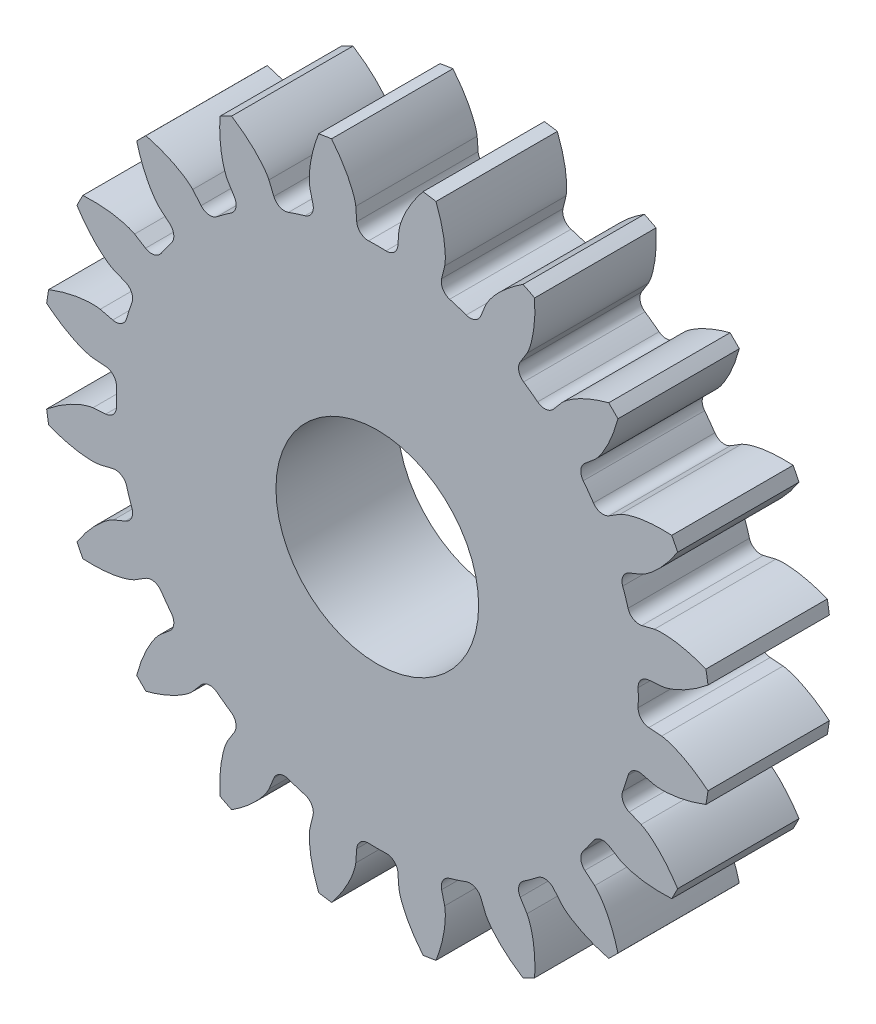
from build123d import *

# Parameters (mm, degrees)
BLANK_SKETCH_R    = 13.75
BLANK_DEPTH       = 5
TOOTH_SPACE_DEPTH = 21.077973005
TEETH_COUNT       = 20
BORE_DEPTH        = 20.90028246
BORE_DEPTH_BACK   = 20.90028246
BORE_SKETCH_R     = 4.175


with BuildPart() as part:
    # Blank Sketch → Blank (new body)
    with BuildSketch(Plane.XY):
        Circle(BLANK_SKETCH_R)
    extrude(amount=BLANK_DEPTH)

    # Tooth Space Sketch → Tooth Space (cut, symmetric)
    with BuildSketch(Plane.XY):
        with BuildLine():
            Line((11.712575542, 0.887578892), (11.182881902, 0.847438712))
            ThreePointArc((11.182881902, 0.847438712), (10.865110495, 0.690887858), (10.744037928, 0.357979056))
            ThreePointArc((10.744037928, 0.357979056), (10.75, 0), (10.744037928, -0.357979056))
            ThreePointArc((10.744037928, -0.357979056), (10.865110495, -0.690887858), (11.182881902, -0.847438712))
            Line((11.182881902, -0.847438712), (11.712575542, -0.887578892))
            add(Edge.make_bspline(
                [(11.712575542, -0.887578892), (11.718030456, -0.888084575), (11.733302224, -0.889786577), (11.762055049, -0.894123642), (11.808748116, -0.902783585), (11.867871522, -0.916136728), (11.943785045, -0.936044148), (12.032491205, -0.962883715), (12.129128281, -0.995906017), (12.233254944, -1.03560915), (12.336170252, -1.078535303), (12.437866469, -1.124417613), (12.538256203, -1.172869671), (12.658707015, -1.234774129), (12.801489519, -1.313454101), (12.965790887, -1.41181046), (13.148934646, -1.53083847), (13.331913845, -1.659992212), (13.508861665, -1.793481702), (13.683836959, -1.93555224), (13.850418726, -2.078105804), (14.019262166, -2.233337092), (14.17300458, -2.380287394), (14.340363277, -2.552637942), (14.474017151, -2.69399985), (14.607838338, -2.84630742), (14.672335873, -2.921355394), (14.70502791, -2.960093607)],
                knots=[0, 0, 0, 0, 0, 0.005376749, 0.015083688, 0.02853182, 0.046610139, 0.064854849, 0.092110525, 0.119476176, 0.146842496, 0.174208854, 0.201574956, 0.228941013, 0.256307345, 0.307035032, 0.361767352, 0.41649966, 0.471231936, 0.525964282, 0.580696615, 0.635428982, 0.690161387, 0.744893688, 0.799626082, 0.854358408, 0.909090915, 0.909090915, 0.909090915, 0.909090915, 0.909090915], degree=4))
            Line((14.70502791, -2.960093607), (14.70502791, 2.960093607))
            add(Edge.make_bspline(
                [(11.712575542, 0.887578892), (11.718030456, 0.888084575), (11.733302224, 0.889786577), (11.762055049, 0.894123642), (11.808748116, 0.902783585), (11.867871522, 0.916136728), (11.943785045, 0.936044148), (12.032491205, 0.962883715), (12.129128281, 0.995906017), (12.233254944, 1.03560915), (12.336170252, 1.078535303), (12.437866469, 1.124417613), (12.538256203, 1.172869671), (12.658707015, 1.234774129), (12.801489519, 1.313454101), (12.965790887, 1.41181046), (13.148934646, 1.53083847), (13.331913845, 1.659992212), (13.508861665, 1.793481702), (13.683836959, 1.93555224), (13.850418726, 2.078105804), (14.019262166, 2.233337092), (14.17300458, 2.380287394), (14.340363277, 2.552637942), (14.474017151, 2.69399985), (14.607838338, 2.84630742), (14.672335873, 2.921355394), (14.70502791, 2.960093607)],
                knots=[0, 0, 0, 0, 0, 0.005376749, 0.015083688, 0.02853182, 0.046610139, 0.064854849, 0.092110525, 0.119476176, 0.146842496, 0.174208854, 0.201574956, 0.228941013, 0.256307345, 0.307035032, 0.361767352, 0.41649966, 0.471231936, 0.525964282, 0.580696615, 0.635428982, 0.690161387, 0.744893688, 0.799626082, 0.854358408, 0.909090915, 0.909090915, 0.909090915, 0.909090915, 0.909090915], degree=4))
        make_face()
    tooth_space = extrude(amount=TOOTH_SPACE_DEPTH, both=True, mode=Mode.SUBTRACT)

    # Teeth: Tooth Space ×20 about axis
    teeth_axis = Axis((0, 0, -0.25007105), (0, 0, 1))
    for i in range(1, TEETH_COUNT):
        add(tooth_space.rotate(teeth_axis, i * 360 / TEETH_COUNT), mode=Mode.SUBTRACT)

    # Bore Sketch → Bore (cut, two sides: drawn at the far end of the back side and taken through both)
    with BuildSketch(Plane.XY.offset(-BORE_DEPTH_BACK)):
        Circle(BORE_SKETCH_R)
    extrude(amount=BORE_DEPTH + BORE_DEPTH_BACK, mode=Mode.SUBTRACT)


solid = part.part
